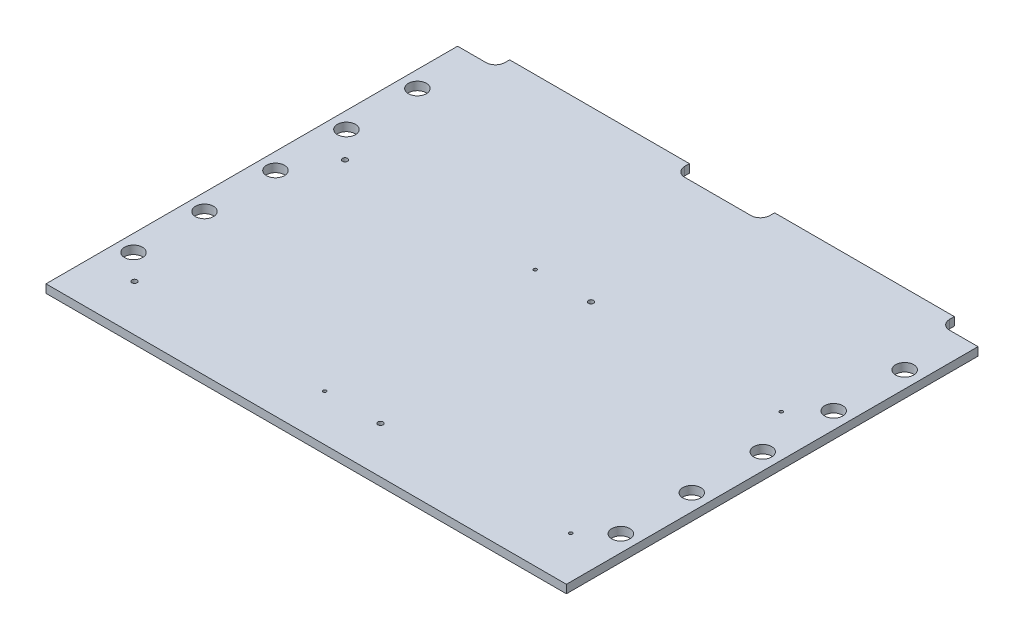
from build123d import *

# Parameters (mm, degrees)
FR4_DEPTH                           = 1.7526
SKETCH7_R                           = 1.905
CUT_EXTRUDE1_DEPTH                  = 143.1375095
SKETCH8_R                           = 0.55
SKETCH8_R_2                         = 0.35
CONTROLLED_DEPTH_HOLES_TOP_DEPTH    = 1.1176
SKETCH9_R                           = 0.55
SKETCH9_R_2                         = 0.35
CONTROLLED_DEPTH_HOLES_BOTTOM_DEPTH = 1.1176


with BuildPart() as part:
    # Sketch1 → FR4 (new body)
    with BuildSketch(Plane(origin=(0, 0, 0), x_dir=(1, 0, 0), z_dir=(0, 1, 0))):
        with BuildLine():
            Line((0, 0), (110, 0))
            Line((110, 0), (110, 87))
            Line((110, 87), (104, 87))
            ThreePointArc((104, 87), (102.585786438, 87.585786438), (102, 89))
            Line((102, 89), (102, 90))
            Line((102, 90), (64, 90))
            Line((64, 90), (64, 89))
            ThreePointArc((64, 89), (63.414213562, 87.585786438), (62, 87))
            Line((62, 87), (48, 87))
            ThreePointArc((48, 87), (46.585786438, 87.585786438), (46, 89))
            Line((46, 89), (46, 90))
            Line((46, 90), (8, 90))
            Line((8, 90), (8, 89))
            ThreePointArc((8, 89), (7.414213562, 87.585786438), (6, 87))
            Line((6, 87), (0, 87))
            Line((0, 87), (0, 0))
        make_face()
    extrude(amount=FR4_DEPTH)

    # Sketch7 → Cut-Extrude1 (cut, through all)
    with BuildSketch(Plane(origin=(0, 1.7526, 0), x_dir=(1, 0, 0), z_dir=(0, 1, 0))):
        with Locations(Location((3.5, 15, 0), (0, 0, 270))):
            Circle(SKETCH7_R)
        with Locations(Location((106.5, 15, 0), (0, 0, 270))):
            Circle(SKETCH7_R)
        with Locations(Location((106.5, 30, 0), (0, 0, 270))):
            Circle(SKETCH7_R)
        with Locations(Location((106.5, 45, 0), (0, 0, 270))):
            Circle(SKETCH7_R)
        with Locations(Location((106.5, 60, 0), (0, 0, 270))):
            Circle(SKETCH7_R)
        with Locations(Location((106.5, 75, 0), (0, 0, 270))):
            Circle(SKETCH7_R)
        with Locations(Location((3.5, 30, 0), (0, 0, 270))):
            Circle(SKETCH7_R)
        with Locations(Location((3.5, 45, 0), (0, 0, 270))):
            Circle(SKETCH7_R)
        with Locations(Location((3.5, 60, 0), (0, 0, 270))):
            Circle(SKETCH7_R)
        with Locations(Location((3.5, 75, 0), (0, 0, 270))):
            Circle(SKETCH7_R)
    extrude(amount=-CUT_EXTRUDE1_DEPTH, mode=Mode.SUBTRACT)

    # Sketch8 → controlled-depth-holes.top (cut)
    with BuildSketch(Plane(origin=(0, 1.7526, 0), x_dir=(1, 0, 0), z_dir=(0, 1, 0))):
        with Locations(Location((8.9, 9.8, 0), (0, 0, 270))):
            Circle(SKETCH8_R)
        with Locations(Location((60.9, 9.8, 0), (0, 0, 270))):
            Circle(SKETCH8_R)
        with Locations(Location((60.9, 54.3, 0), (0, 0, 270))):
            Circle(SKETCH8_R)
        with Locations(Location((8.9, 54.3, 0), (0, 0, 270))):
            Circle(SKETCH8_R)
        with Locations(Location((49.1, 9.8, 0), (0, 0, 270))):
            Circle(SKETCH8_R_2)
        with Locations(Location((101.1, 9.8, 0), (0, 0, 270))):
            Circle(SKETCH8_R_2)
        with Locations(Location((101.1, 54.3, 0), (0, 0, 270))):
            Circle(SKETCH8_R_2)
        with Locations(Location((49.1, 54.3, 0), (0, 0, 270))):
            Circle(SKETCH8_R_2)
    extrude(amount=-CONTROLLED_DEPTH_HOLES_TOP_DEPTH, mode=Mode.SUBTRACT)

    # Sketch9 → controlled-depth-holes.bottom (cut)
    with BuildSketch(Plane.XZ):
        with Locations(Location((8.9, -9.5, 0), (0, 0, 270))):
            Circle(SKETCH9_R)
        with Locations(Location((60.9, -9.5, 0), (0, 0, 270))):
            Circle(SKETCH9_R)
        with Locations(Location((60.9, -54, 0), (0, 0, 270))):
            Circle(SKETCH9_R)
        with Locations(Location((8.9, -54, 0), (0, 0, 270))):
            Circle(SKETCH9_R)
        with Locations(Location((49.1, -9.5, 0), (0, 0, 270))):
            Circle(SKETCH9_R_2)
        with Locations(Location((101.1, -9.5, 0), (0, 0, 270))):
            Circle(SKETCH9_R_2)
        with Locations(Location((101.1, -54, 0), (0, 0, 270))):
            Circle(SKETCH9_R_2)
        with Locations(Location((49.1, -54, 0), (0, 0, 270))):
            Circle(SKETCH9_R_2)
    extrude(amount=-CONTROLLED_DEPTH_HOLES_BOTTOM_DEPTH, mode=Mode.SUBTRACT)


solid = part.part
